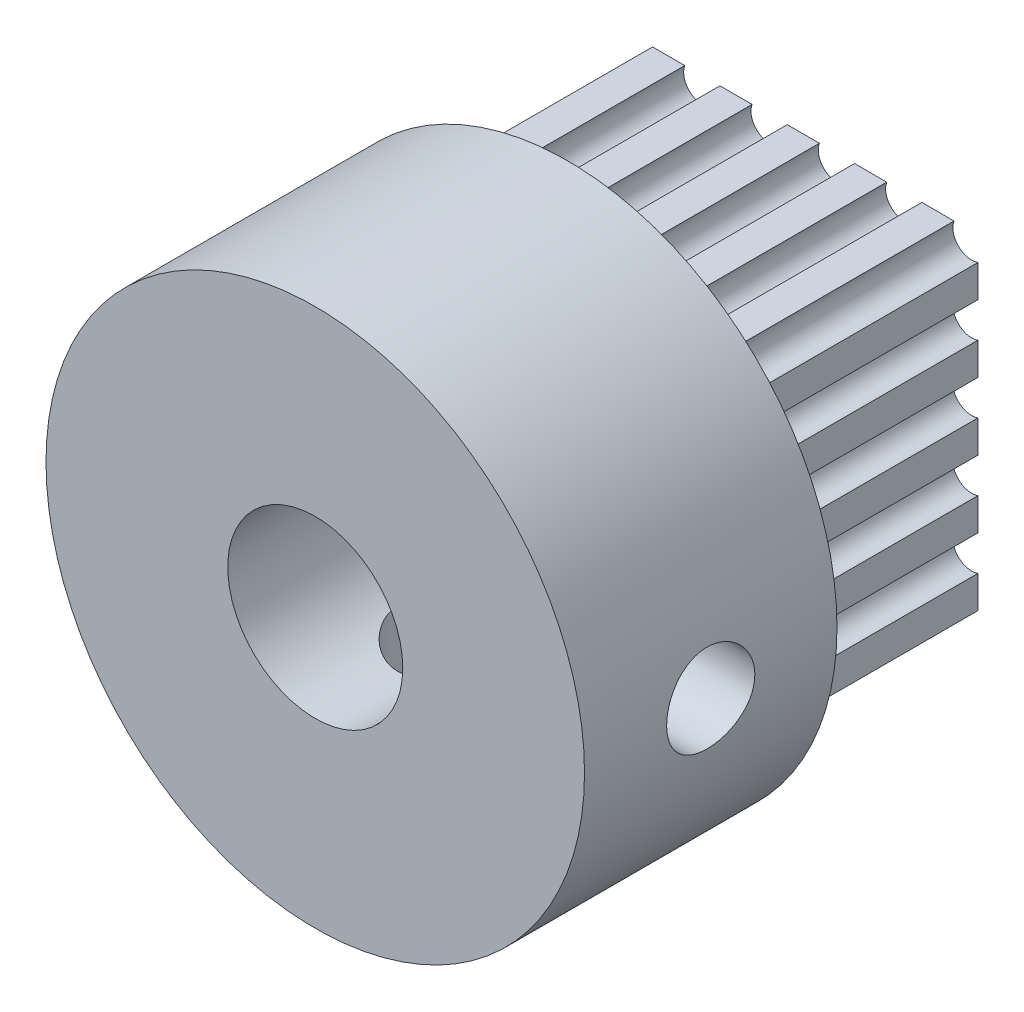
from build123d import *

# Parameters (mm, degrees)
SKETCH2_R               = 4.1
SKETCH2_R_2             = 2.6
BOSS_EXTRUDE1_DEPTH     = 7
SKETCH3_R               = 8
SKETCH3_R_2             = 2.6
BOSS_EXTRUDE2_DEPTH     = 7.5
SKETCH4_R               = 1.31
CUT_EXTRUDE1_DEPTH      = 9
CUT_EXTRUDE2_DEPTH      = 5
CUT_EXTRUDE2_DEPTH_BACK = 2
SKETCH5_R               = 1.31


with BuildPart() as part:
    # Sketch2 → Boss-Extrude1 (new body)
    # profile 1 of 2: a face of its own
    with BuildSketch(Plane.XY):
        with BuildLine():
            ThreePointArc((-8.388352144, 2.232508627), (-7.643352144, 2.753972912), (-8.388352144, 3.275437196))
            Line((-8.388352144, 3.275437196), (-8.388352144, 4.232508627))
            ThreePointArc((-8.388352144, 4.232508627), (-7.805907881, 4.361528648), (-7.67688786, 4.943972912))
            Line((-7.67688786, 4.943972912), (-6.719816429, 4.943972912))
            ThreePointArc((-6.719816429, 4.943972912), (-6.198352144, 4.198972912), (-5.67688786, 4.943972912))
            Line((-5.67688786, 4.943972912), (-4.719816429, 4.943972912))
            ThreePointArc((-4.719816429, 4.943972912), (-4.198352144, 4.198972912), (-3.67688786, 4.943972912))
            Line((-3.67688786, 4.943972912), (-2.719816429, 4.943972912))
            ThreePointArc((-2.719816429, 4.943972912), (-2.198352144, 4.198972912), (-1.67688786, 4.943972912))
            Line((-1.67688786, 4.943972912), (-0.719816429, 4.943972912))
            ThreePointArc((-0.719816429, 4.943972912), (-0.198352144, 4.198972912), (0.32311214, 4.943972912))
            Line((0.32311214, 4.943972912), (1.280183571, 4.943972912))
            ThreePointArc((1.280183571, 4.943972912), (1.409203592, 4.361528648), (1.991647856, 4.232508627))
            Line((1.991647856, 4.232508627), (1.991647856, 3.275437196))
            ThreePointArc((1.991647856, 3.275437196), (1.246647856, 2.753972912), (1.991647856, 2.232508627))
            Line((1.991647856, 2.232508627), (1.991647856, 1.275437196))
            ThreePointArc((1.991647856, 1.275437196), (1.246647856, 0.753972912), (1.991647856, 0.232508627))
            Line((1.991647856, 0.232508627), (1.991647856, -0.724562804))
            ThreePointArc((1.991647856, -0.724562804), (1.246647856, -1.246027088), (1.991647856, -1.767491373))
            Line((1.991647856, -1.767491373), (1.991647856, -2.724562804))
            ThreePointArc((1.991647856, -2.724562804), (1.246647856, -3.246027088), (1.991647856, -3.767491373))
            Line((1.991647856, -3.767491373), (1.991647856, -4.724562804))
            ThreePointArc((1.991647856, -4.724562804), (1.409203592, -4.853582824), (1.280183571, -5.436027088))
            Line((1.280183571, -5.436027088), (0.32311214, -5.436027088))
            ThreePointArc((0.32311214, -5.436027088), (-0.198352144, -4.691027088), (-0.719816429, -5.436027088))
            Line((-0.719816429, -5.436027088), (-1.67688786, -5.436027088))
            ThreePointArc((-1.67688786, -5.436027088), (-2.198352144, -4.691027088), (-2.719816429, -5.436027088))
            Line((-2.719816429, -5.436027088), (-3.67688786, -5.436027088))
            ThreePointArc((-3.67688786, -5.436027088), (-4.198352144, -4.691027088), (-4.719816429, -5.436027088))
            Line((-4.719816429, -5.436027088), (-5.67688786, -5.436027088))
            ThreePointArc((-5.67688786, -5.436027088), (-6.198352144, -4.691027088), (-6.719816429, -5.436027088))
            Line((-6.719816429, -5.436027088), (-7.67688786, -5.436027088))
            ThreePointArc((-7.67688786, -5.436027088), (-7.805907881, -4.853582824), (-8.388352144, -4.724562804))
            Line((-8.388352144, -4.724562804), (-8.388352144, -3.767491373))
            ThreePointArc((-8.388352144, -3.767491373), (-7.643352144, -3.246027088), (-8.388352144, -2.724562804))
            Line((-8.388352144, -2.724562804), (-8.388352144, -1.767491373))
            ThreePointArc((-8.388352144, -1.767491373), (-7.643352144, -1.246027088), (-8.388352144, -0.724562804))
            Line((-8.388352144, -0.724562804), (-8.388352144, 0.232508627))
            ThreePointArc((-8.388352144, 0.232508627), (-7.643352144, 0.753972912), (-8.388352144, 1.275437196))
            Line((-8.388352144, 1.275437196), (-8.388352144, 2.232508627))
        make_face()
        with Locations((-3.198352144, -0.246027088)):
            Circle(SKETCH2_R, mode=Mode.SUBTRACT)
    # profile 2 of 2: a face of its own
    with BuildSketch(Plane.XY):
        with Locations((-3.198352144, -0.246027088)):
            Circle(SKETCH2_R)
        with Locations((-3.198352144, -0.246027088)):
            Circle(SKETCH2_R_2, mode=Mode.SUBTRACT)
    extrude(amount=BOSS_EXTRUDE1_DEPTH)

    # Sketch3 → Boss-Extrude2 (add)
    with BuildSketch(Plane.XY.offset(7)):
        with Locations((-3.198352144, -0.246027088)):
            Circle(SKETCH3_R)
        with Locations((-3.198352144, -0.246027088)):
            Circle(SKETCH3_R_2, mode=Mode.SUBTRACT)
    extrude(amount=BOSS_EXTRUDE2_DEPTH)

    # Sketch4 → Cut-Extrude1 (cut)
    with BuildSketch(Plane(origin=(0, 0, 0), x_dir=(1, 0, 0), z_dir=(0, 1, 0))):
        with Locations(Location((-3.198352144, -10.75, 0), (0, 0, 270))):
            Circle(SKETCH4_R)
    extrude(amount=-CUT_EXTRUDE1_DEPTH, mode=Mode.SUBTRACT)

    # Sketch5 → Cut-Extrude2 (cut, two sides: drawn at the far end of the back side and taken through both)
    with BuildSketch(Plane(origin=(0, 0, 0), x_dir=(0, 0, -1), z_dir=(1, 0, 0)).offset(-CUT_EXTRUDE2_DEPTH_BACK)):
        with Locations((-10.75, -0.246027088)):
            Circle(SKETCH5_R)
    extrude(amount=CUT_EXTRUDE2_DEPTH + CUT_EXTRUDE2_DEPTH_BACK, mode=Mode.SUBTRACT)


solid = part.part
